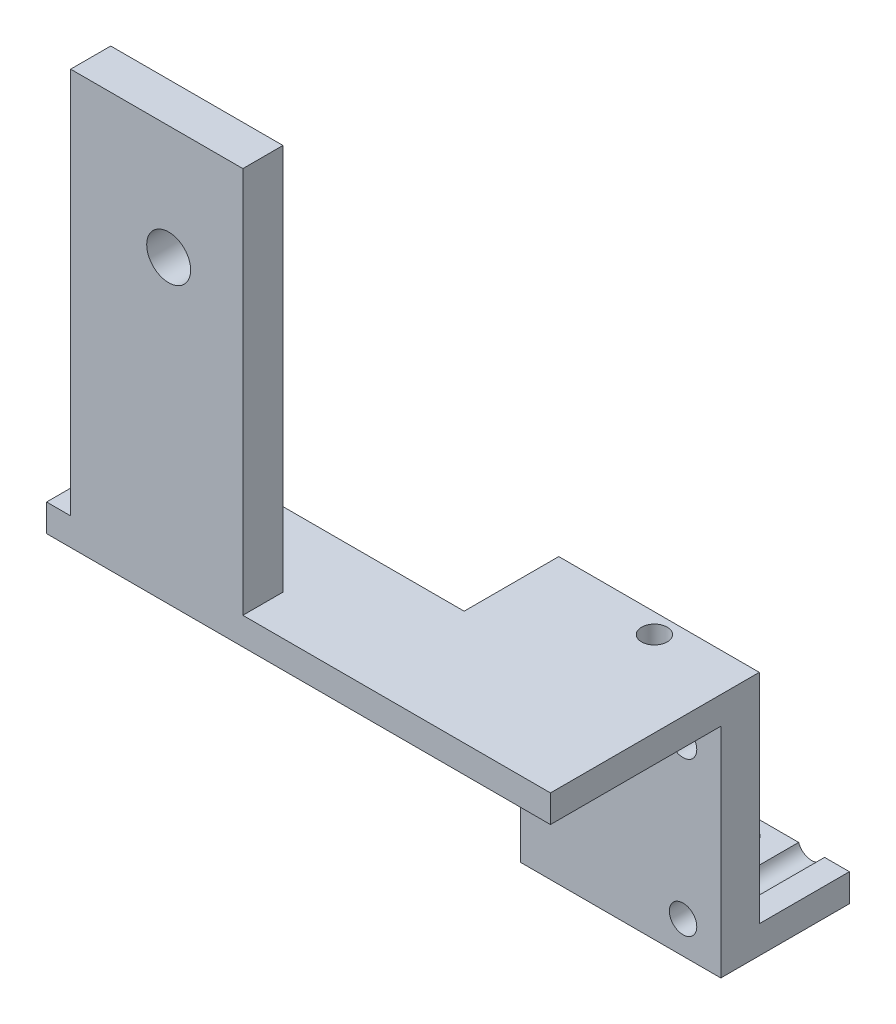
from build123d import *

# Parameters (mm, degrees)
SKETCH1_R           = 1.5875
BOSS_EXTRUDE1_DEPTH = 4.445
BOSS_EXTRUDE2_START = 10.414
BOSS_EXTRUDE2_DEPTH = 10.414
SKETCH1_6_W         = 23.172043576
SKETCH1_6_H         = 3.169044436
BOSS_EXTRUDE3_DEPTH = 24.13
SKETCH4_W           = 13.196572836
SKETCH4_H           = 3.169044436
BOSS_EXTRUDE4_DEPTH = 35.052
SKETCH5_W           = 19.900905811
SKETCH5_H           = 4.632500987
BOSS_EXTRUDE5_DEPTH = 44.704
SKETCH6_R           = 2.54
CUT_EXTRUDE1_DEPTH  = 89.552863771
SKETCH7_R           = 1.994892348
SKETCH7_R_2         = 1.482380007
SKETCH7_R_3         = 1.560959408
CUT_EXTRUDE2_DEPTH  = 87.581521828


with BuildPart() as part:
    # Sketch1 → Boss-Extrude1 (new body)
    with BuildSketch(Plane.XY):
        with BuildLine():
            Line((18.539023024, 28.590004207), (-4.633020552, 28.590004207))
            Line((-4.633020552, 28.590004207), (-4.633020552, 14.359873942))
            ThreePointArc((-4.633020552, 14.359873942), (-4.114966432, 12.822559771), (-4.633020552, 11.2852456))
            Line((-4.633020552, 11.2852456), (-4.633020552, 0.224159771))
            Line((-4.633020552, 0.224159771), (18.539023024, 0.224159771))
            Line((18.539023024, 0.224159771), (18.539023024, 28.590004207))
        make_face()
        with Locations((14.173033568, 21.687159771)):
            Circle(SKETCH1_R, mode=Mode.SUBTRACT)
        with Locations((14.173033568, 3.957959771)):
            Circle(SKETCH1_R, mode=Mode.SUBTRACT)
    extrude(amount=BOSS_EXTRUDE1_DEPTH)

    # Sketch2 → Boss-Extrude2 (add)
    with BuildSketch(Plane(origin=(0, 0, 0), x_dir=(-1, 0, 0), z_dir=(0, 0, -1)).offset(BOSS_EXTRUDE2_START)):
        with BuildLine():
            Line((-18.539023024, 3.433695859), (-15.671467284, 3.433695859))
            ThreePointArc((-15.671467284, 3.433695859), (-14.173033568, 2.370459771), (-12.674599853, 3.433695859))
            Line((-12.674599853, 3.433695859), (4.633020552, 3.433695859))
            Line((4.633020552, 3.433695859), (4.633020552, 0.224159771))
            Line((4.633020552, 0.224159771), (-18.539023024, 0.224159771))
            Line((-18.539023024, 0.224159771), (-18.539023024, 3.433695859))
        make_face()
    extrude(amount=-BOSS_EXTRUDE2_DEPTH)

    # Sketch1<6> → Boss-Extrude3 (add)
    with BuildSketch(Plane.XY):
        with Locations((6.953001236, 27.005481989)):
            Rectangle(SKETCH1_6_W, SKETCH1_6_H)
    extrude(amount=BOSS_EXTRUDE3_DEPTH)

    # Sketch4 → Boss-Extrude4 (add)
    with BuildSketch(Plane.ZY.offset(4.633020552)):
        with Locations((17.531713582, 27.005481989)):
            Rectangle(SKETCH4_W, SKETCH4_H)
    extrude(amount=BOSS_EXTRUDE4_DEPTH)

    # Sketch5 → Boss-Extrude5 (add)
    with BuildSketch(Plane(origin=(0, 28.590004207, 0), x_dir=(1, 0, 0), z_dir=(0, 1, 0))):
        with Locations((-26.955814506, -21.813749507)):
            Rectangle(SKETCH5_W, SKETCH5_H)
    extrude(amount=BOSS_EXTRUDE5_DEPTH)

    # Sketch6 → Cut-Extrude1 (cut, through all)
    with BuildSketch(Plane(origin=(0, 0, 19.497499013), x_dir=(-1, 0, 0), z_dir=(0, 0, -1))):
        with Locations((25.576990215, 60.125767425)):
            Circle(SKETCH6_R)
    extrude(amount=-CUT_EXTRUDE1_DEPTH, mode=Mode.SUBTRACT)

    # Sketch7 → Cut-Extrude2 (cut, through all)
    with BuildSketch(Plane.XZ.offset(-0.224159771)):
        with Locations((-0.152967162, -2.724793136)):
            Circle(SKETCH7_R)
        with Locations((8.696595836, 2.276499013)):
            Circle(SKETCH7_R_2)
        with Locations((8.696595836, -7.723500987)):
            Circle(SKETCH7_R_3)
    extrude(amount=-CUT_EXTRUDE2_DEPTH, mode=Mode.SUBTRACT)


solid = part.part
